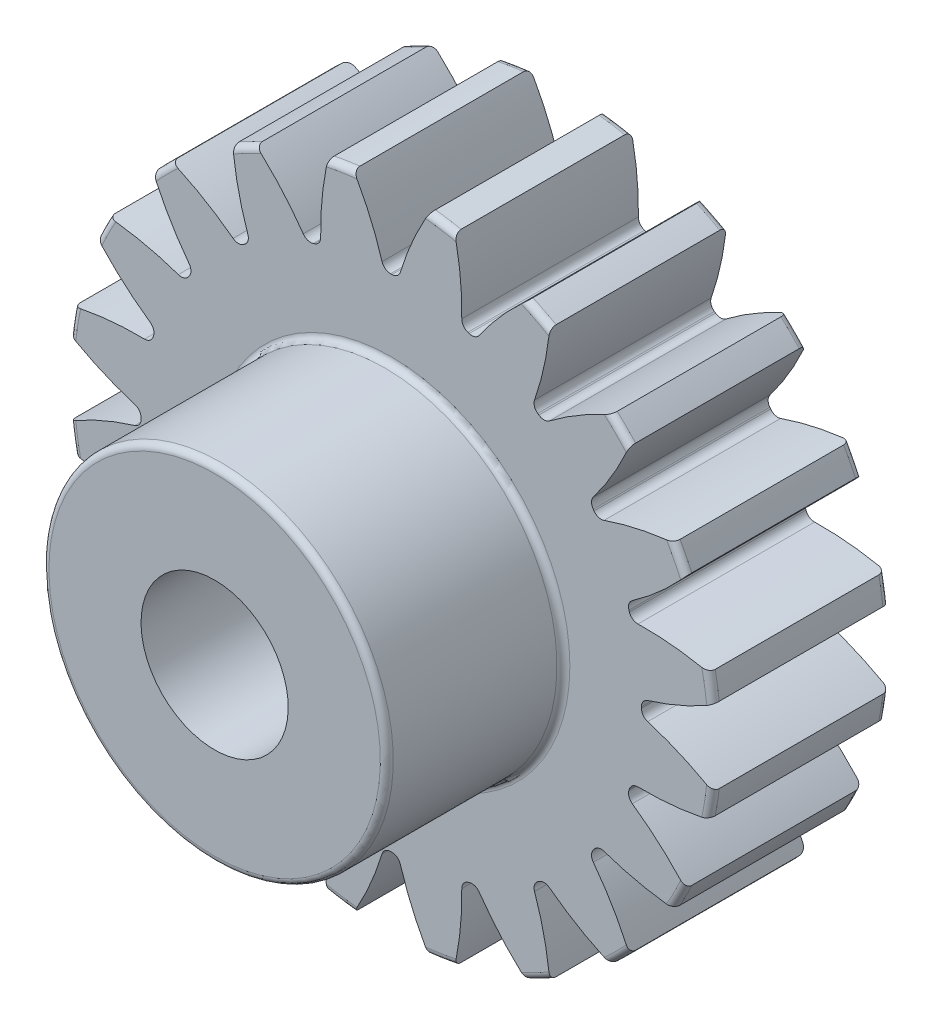
from build123d import *

# Parameters (mm, degrees)
FILLET2_R          = 0.21999999999999997
CUT_EXTRUDE2_DEPTH = 17.673332066506685
CIRPATTERN1_COUNT  = 20


with BuildPart() as part:
    # Sketch4 → Revolve1 (revolve)
    with BuildSketch(Plane(origin=(0, 0, 0), x_dir=(0, 0, -1), z_dir=(1, 0, 0))):
        Polygon((-12, 2.5), (-12, 5.85), (-6.000000000000001, 5.85), (-6.000000000000001, 11), (0, 11), (0, 2.5), align=None)
    revolve(axis=Axis((0, -2.4e-16, 6), (0, -1.2e-16, 1)))

    # Fillet2
    fillet2_edges = [part.edges().sort_by_distance(p)[0] for p in [
        (-6.23e-15, -11, -3.12e-15),
        (-6.23e-15, -11, 5.999999999999997),
        (-3.31e-15, -5.85, 5.999999999999999),
        (-7.2e-16, -5.850000000000001, 12),
    ]]
    fillet(fillet2_edges, radius=FILLET2_R)

    # Sketch7 → Cut-Extrude2 (cut, through all)
    with BuildSketch(Plane.XY.offset(6)):
        with BuildLine():
            ThreePointArc((-0.02318857258652449, 8.499968369947116), (5.2e-16, 8.500000000000002), (0.02318857258652449, 8.499968369947116))
            ThreePointArc((0.02318857258652449, 8.499968369947116), (0.20255010173258228, 8.55887608142424), (0.3112175368654209, 8.713252456400253))
            ThreePointArc((0.3112175368654209, 8.713252456400253), (0.7305635670890176, 9.848515279226675), (1.2839804656445486, 10.924806367338654))
            ThreePointArc((1.2839804656445486, 10.924806367338654), (6.7e-16, 11), (-1.2839804656445486, 10.924806367338654))
            ThreePointArc((-1.2839804656445486, 10.924806367338654), (-0.7305635670890176, 9.848515279226671), (-0.3112175368654209, 8.713252456400253))
            ThreePointArc((-0.3112175368654209, 8.713252456400253), (-0.2025501017325823, 8.55887608142424), (-0.02318857258652449, 8.499968369947116))
        make_face()
    cut_extrude2 = extrude(amount=-CUT_EXTRUDE2_DEPTH, mode=Mode.SUBTRACT)

    # CirPattern1: Cut-Extrude2 ×20 about axis
    cirpattern1_axis = Axis((2.11e-15, -3e-17, 0), (0, 0, 1))
    for i in range(1, CIRPATTERN1_COUNT):
        add(cut_extrude2.rotate(cirpattern1_axis, i * 360 / CIRPATTERN1_COUNT), mode=Mode.SUBTRACT)


solid = part.part
